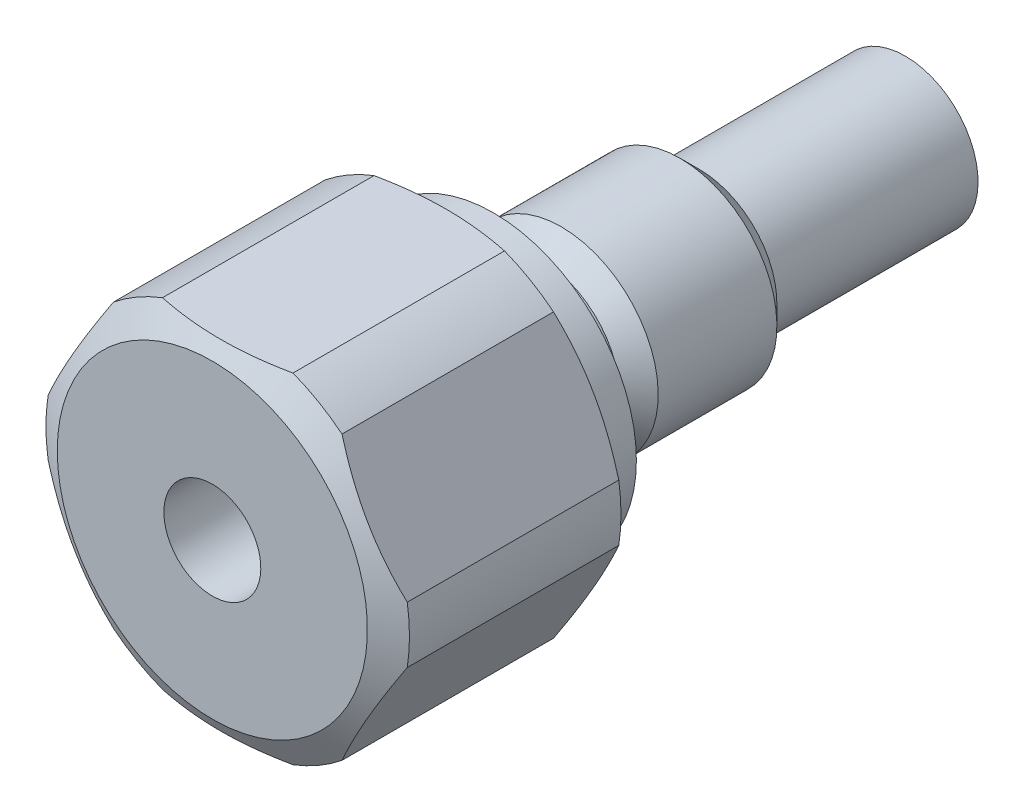
from build123d import *

# Parameters (mm, degrees)
HEX_START      = -10
SKETCH3_R      = 2
HEX_HEAD_DEPTH = 10


with BuildPart() as part:
    # Sketch1 → Main Base (revolve)
    with BuildSketch(Plane(origin=(0, 0, 0), x_dir=(0, 0, -1), z_dir=(1, 0, 0))):
        Polygon((0, 2), (0, 3), (-8.5, 3), (-8.5, 3.2), (-9.3, 4), (-14.2, 4), (-15, 3.2), (-17, 3.2), (-17, 5.9), (-18.6, 5.9), (-18.6, 7), (-28.6, 7), (-28.6, 2), align=None)
    revolve(axis=Axis((0, 0, -105.38083184), (0, 0, 1)))

    # Sketch3 → Hex Head (add)
    with BuildSketch(Plane.XY.offset(28.6).offset(HEX_START)):
        Polygon((8.082903769, 0), (4.041451884, 7), (-4.041451884, 7), (-8.082903769, 0), (-4.041451884, -7), (4.041451884, -7), align=None)
        with Locations(Location((0, 0, 0), (0, 0, 90))):
            Circle(SKETCH3_R, mode=Mode.SUBTRACT)
    extrude(amount=HEX_HEAD_DEPTH)

    # Sketch5 → Hex Trim (revolve, cut)
    with BuildSketch(Plane(origin=(0, 0, 0), x_dir=(1, 0, 0), z_dir=(0, 1, 0)), mode=Mode.PRIVATE) as hex_trim_sk:
        Polygon((-6.4, -18.6), (-7.5, -19.235085296), (-7.5, -27.964914704), (-6.4, -28.6), (-8.082903769, -28.6), (-8.082903769, -18.6), align=None)
    revolve(hex_trim_sk.sketch.rotate(Axis((0, 0, 20.51194439), (0, 0, 1)), 188.960530202), axis=Axis((0, 0, 20.51194439), (0, 0, 1)), mode=Mode.SUBTRACT)


solid = part.part
